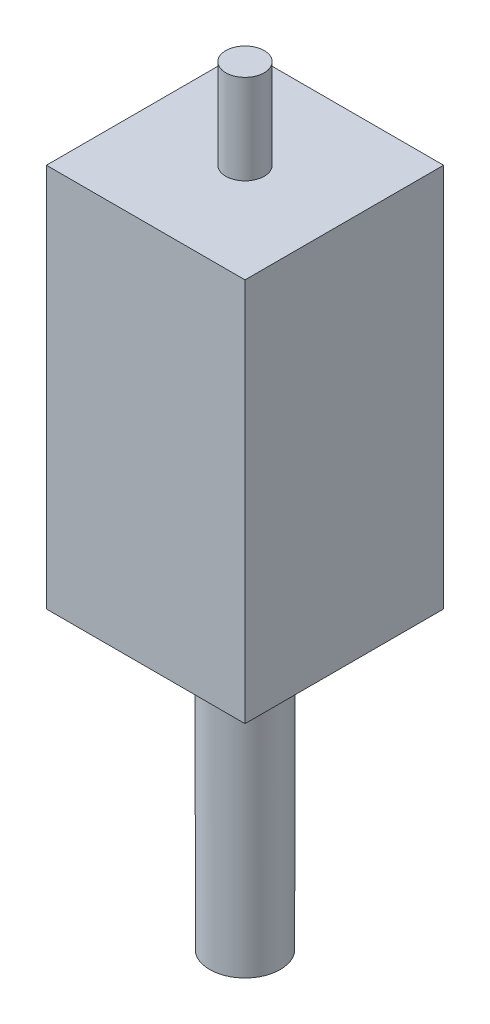
from build123d import *

# Parameters (mm, degrees)
ESBO_O2_W                                   = 15.5
ESBO_O2_H                                   = 30
RESSALTO_EXTRUS_O1_DEPTH                    = 15.5
ESBO_O3_R                                   = 1.5
RESSALTO_EXTRUS_O2_DEPTH                    = 7
ESBO_O4_R                                   = 2.75
RESSALTO_EXTRUS_O3_DEPTH                    = 23
BROCA_DE_ROSQUEAR_PARA_TARRAXA_DE_M31_D     = 2.5
BROCA_DE_ROSQUEAR_PARA_TARRAXA_DE_M31_DEPTH = 1.1
BROCA_DE_ROSQUEAR_PARA_TARRAXA_DE_M31_TIP   = 0.751075774


with BuildPart() as part:
    # Esboço2 → Ressalto-extrusão1 (new body)
    with BuildSketch(Plane.XY):
        with Locations((6.870290308, 0.804951604)):
            Rectangle(ESBO_O2_W, ESBO_O2_H)
    extrude(amount=RESSALTO_EXTRUS_O1_DEPTH)

    # Esboço3 → Ressalto-extrusão2 (add)
    with BuildSketch(Plane(origin=(0, 15.804951604, 0), x_dir=(1, 0, 0), z_dir=(0, 1, 0))):
        with Locations(Location((6.870290308, -7.75, 0), (0, 0, 90))):
            Circle(ESBO_O3_R)
    extrude(amount=RESSALTO_EXTRUS_O2_DEPTH)

    # Esboço4 → Ressalto-extrusão3 (add)
    with BuildSketch(Plane.XZ.offset(14.195048396)):
        with Locations(Location((6.870290308, 7.75, 0), (0, 0, 180))):
            Circle(ESBO_O4_R)
    extrude(amount=RESSALTO_EXTRUS_O3_DEPTH)

    # Broca de rosquear para tarraxa de M31
    with Locations(Plane(origin=(-0.879709692, 8.304951604, 7.75), x_dir=(0, -1, 0), z_dir=(-1, 0, 0))):
        with Locations((0, 0), (15, 0)):
            Hole(BROCA_DE_ROSQUEAR_PARA_TARRAXA_DE_M31_D / 2, depth=BROCA_DE_ROSQUEAR_PARA_TARRAXA_DE_M31_DEPTH)
            with Locations((0, 0, -(BROCA_DE_ROSQUEAR_PARA_TARRAXA_DE_M31_DEPTH + BROCA_DE_ROSQUEAR_PARA_TARRAXA_DE_M31_TIP / 2))):  # 118° drill point
                Cone(0, BROCA_DE_ROSQUEAR_PARA_TARRAXA_DE_M31_D / 2, BROCA_DE_ROSQUEAR_PARA_TARRAXA_DE_M31_TIP, mode=Mode.SUBTRACT)


solid = part.part
